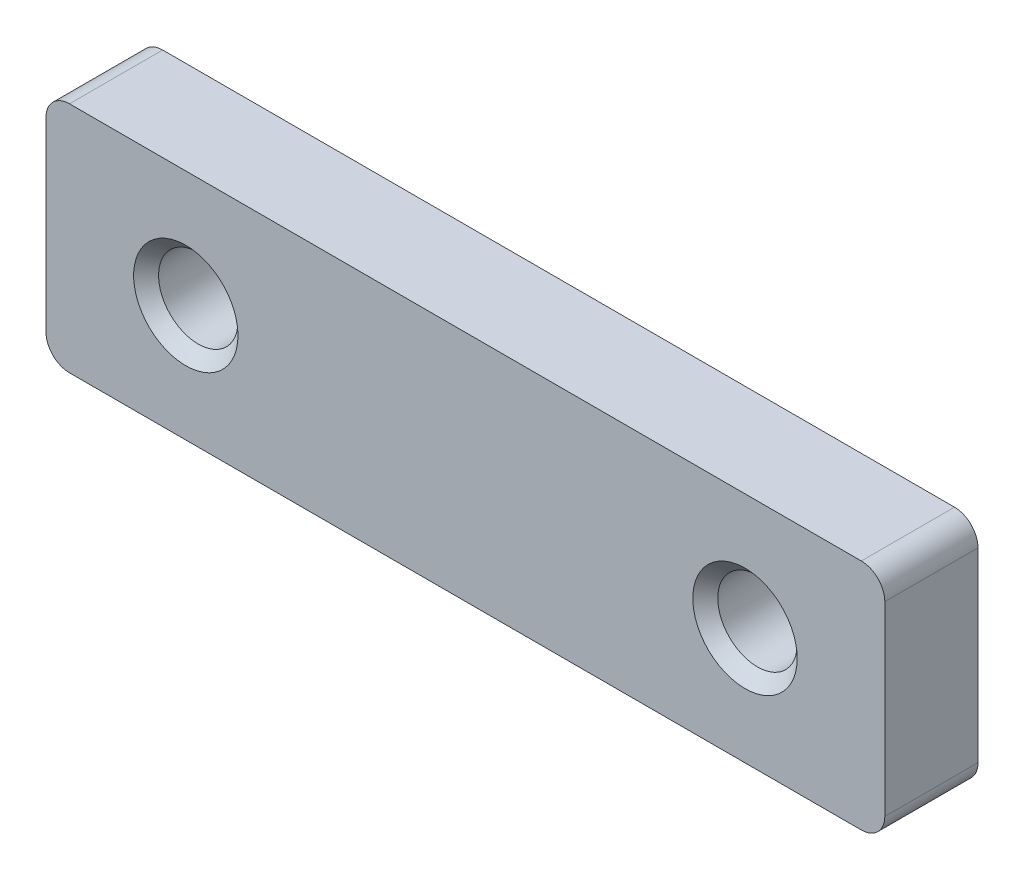
from build123d import *

# Parameters (mm, degrees)
SKETCH1_W                        = 57.15
SKETCH1_H                        = 15.875
BOSS_EXTRUDE1_DEPTH              = 6.35
F_1_4_28_TAPPED_HOLE1_AT_2_COUNT = 2
F_1_4_28_TAPPED_HOLE1_AT_2_PITCH = 38.1
FILLET1_R                        = 1.6002


with BuildPart() as part:
    # Sketch1 → Boss-Extrude1 (new body)
    with BuildSketch(Plane.XY):
        Rectangle(SKETCH1_W, SKETCH1_H)
    extrude(amount=-BOSS_EXTRUDE1_DEPTH)

    # Sketch2 → 1/4-28 Tapped Hole1 (revolve, cut)
    with BuildSketch(Plane(origin=(19.05, 0, 0), x_dir=(0, -1, 0), z_dir=(1, 0, 0))):
        Polygon((0, 0), (0, 6.35), (3.556, 6.35), (2.7051, 5.4991), (2.7051, 0.8509), (3.556, 0), align=None)
    f_1_4_28_tapped_hole1 = revolve(axis=Axis((19.05, 0, 6.35), (0, 0, -1)), mode=Mode.SUBTRACT)

    # 1/4-28 Tapped Hole1 at 2: 1/4-28 Tapped Hole1 ×2
    with Locations(*[(-i * F_1_4_28_TAPPED_HOLE1_AT_2_PITCH, 0, 0) for i in range(1, F_1_4_28_TAPPED_HOLE1_AT_2_COUNT)]):
        add(f_1_4_28_tapped_hole1, mode=Mode.SUBTRACT)

    # Fillet1
    fillet1_edges = [part.edges().sort_by_distance(p)[0] for p in [
        (-28.575, 7.9375, -3.175),
        (28.575, 7.9375, -3.175),
        (28.575, -7.9375, -3.175),
        (-28.575, -7.9375, -3.175),
    ]]
    fillet(fillet1_edges, radius=FILLET1_R)


solid = part.part
